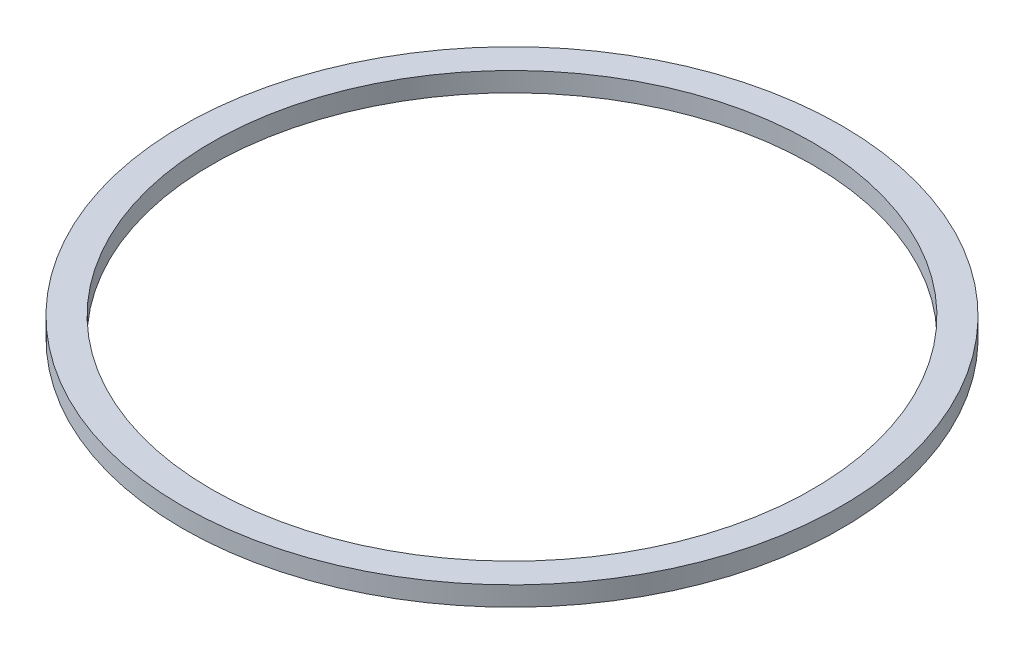
from build123d import *

# Parameters (mm, degrees)
ESQUISSE1_R        = 17
ESQUISSE1_R_2      = 15.5
BOSS_EXTRU_1_DEPTH = 1


with BuildPart() as part:
    # Esquisse1 → Boss.-Extru.1 (new body)
    with BuildSketch(Plane(origin=(0, 0, 0), x_dir=(1, 0, 0), z_dir=(0, 1, 0))):
        with Locations(Location((0, 0, 0), (0, 0, 270))):
            Circle(ESQUISSE1_R)
        with Locations(Location((0, 0, 0), (0, 0, 270))):
            Circle(ESQUISSE1_R_2, mode=Mode.SUBTRACT)
    extrude(amount=BOSS_EXTRU_1_DEPTH)


solid = part.part
